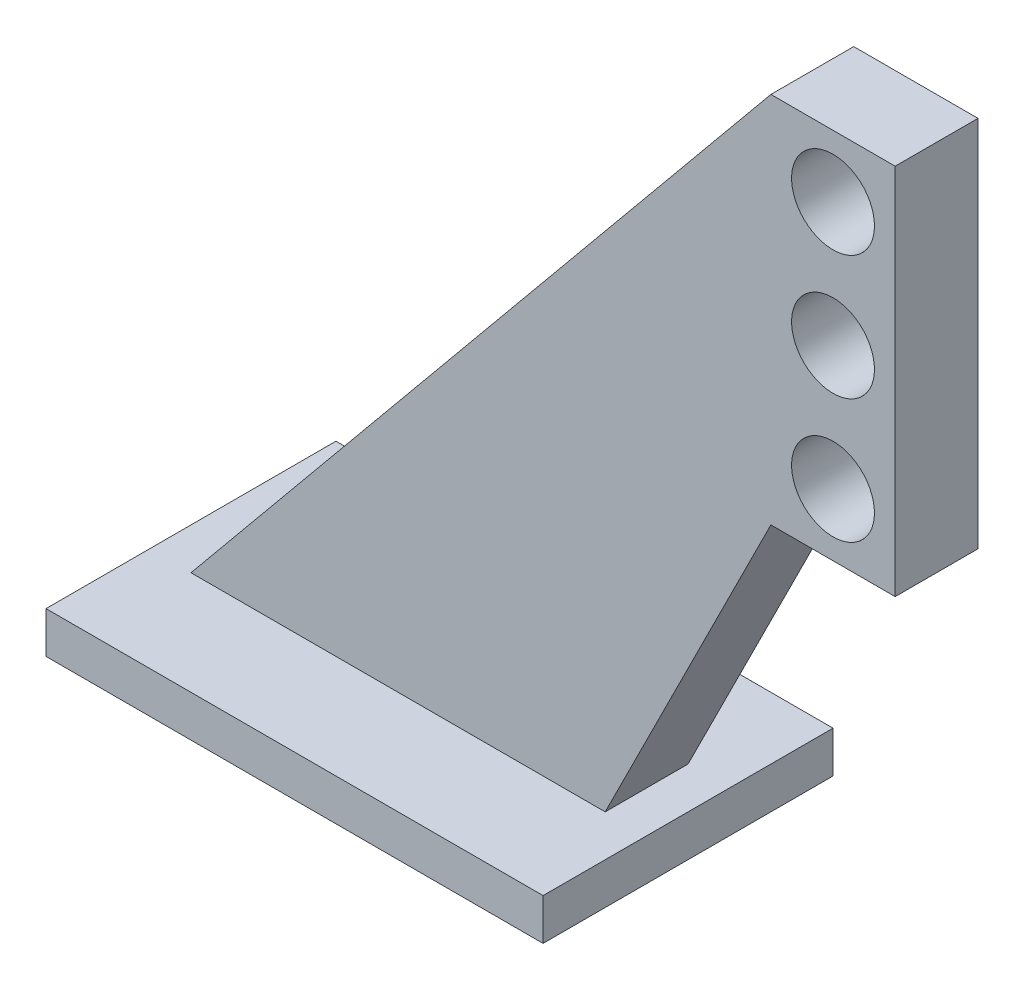
from build123d import *

# Parameters (mm, degrees)
SCHIZZO1_R                   = 1
ESTRUSIONE_ESTRUSIONE1_DEPTH = 2
SCHIZZO2_W                   = 12
SCHIZZO2_H                   = 7
ESTRUSIONE_ESTRUSIONE2_DEPTH = 1


with BuildPart() as part:
    # Schizzo1 → Estrusione-Estrusione1 (new body)
    with BuildSketch(Plane.XY):
        Polygon((0, 0), (10, 0), (14, 8), (17, 8), (17, 17), (14, 17), align=None)
        with Locations((15.5, 15.5)):
            Circle(SCHIZZO1_R, mode=Mode.SUBTRACT)
        with Locations((15.5, 12.5)):
            Circle(SCHIZZO1_R, mode=Mode.SUBTRACT)
        with Locations((15.5, 9.5)):
            Circle(SCHIZZO1_R, mode=Mode.SUBTRACT)
    extrude(amount=ESTRUSIONE_ESTRUSIONE1_DEPTH)

    # Schizzo2 → Estrusione-Estrusione2 (add)
    with BuildSketch(Plane.XZ):
        with Locations((5, 1)):
            Rectangle(SCHIZZO2_W, SCHIZZO2_H)
    extrude(amount=ESTRUSIONE_ESTRUSIONE2_DEPTH)


solid = part.part
